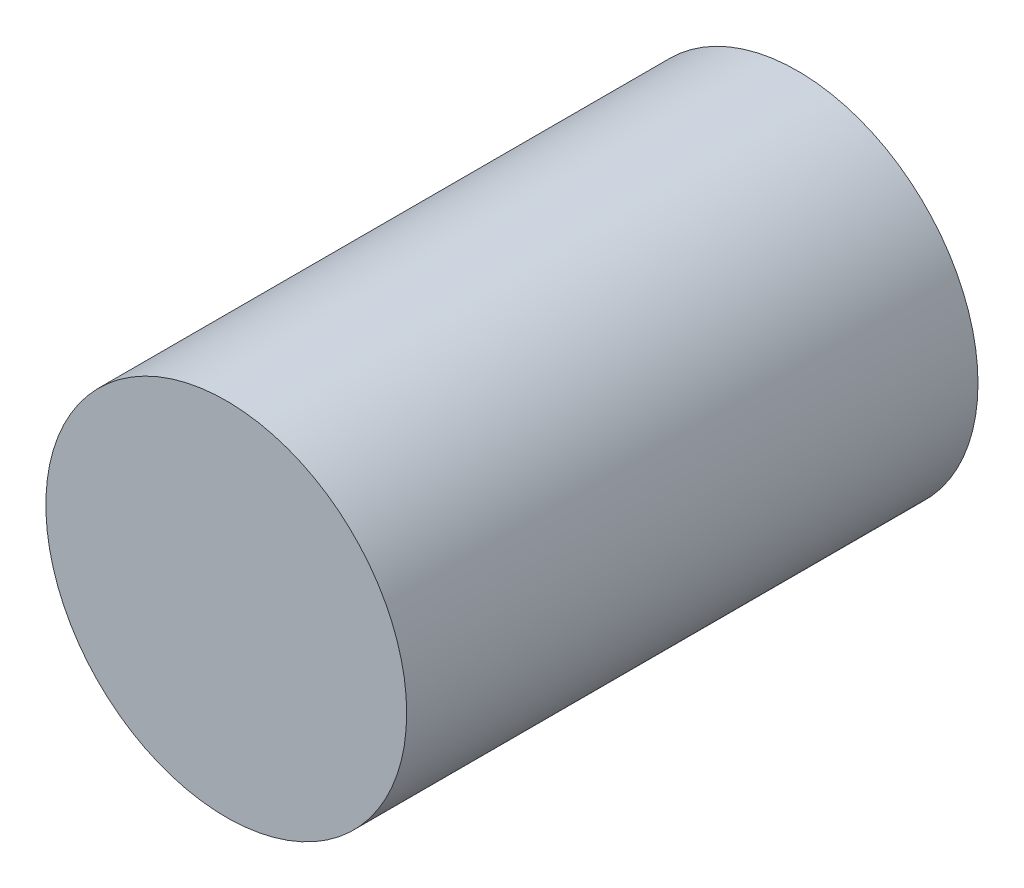
from build123d import *

# Parameters (mm, degrees)
SKETCH_1_R           = 3
CABLE_ENVELOPE_DEPTH = 9.5


with BuildPart() as part:
    # 草图1 → Cable_envelope (new body)
    with BuildSketch(Plane.XY):
        Circle(SKETCH_1_R)
    extrude(amount=CABLE_ENVELOPE_DEPTH)


solid = part.part
